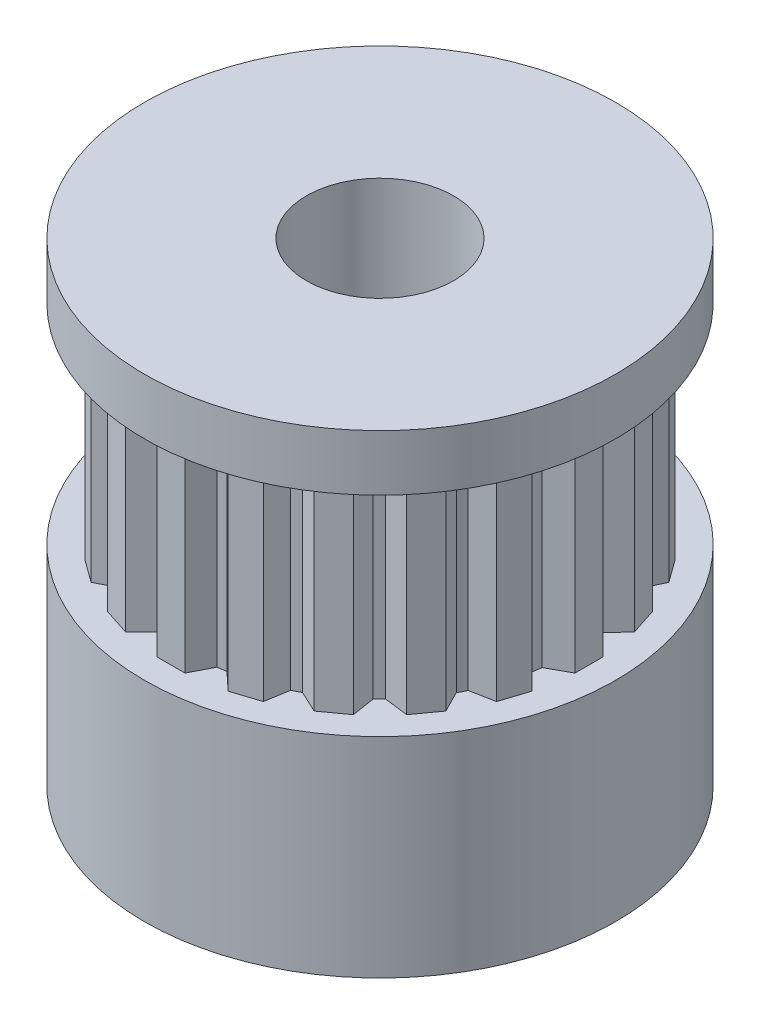
from build123d import *

# Parameters (mm, degrees)
SKETCH1_R               = 8
BOSS_EXTRUDE1_DEPTH     = 7.1
BOSS_EXTRUDE2_DEPTH     = 7.1
SKETCH3_R               = 8
BOSS_EXTRUDE3_DEPTH     = 1.9
CUT_EXTRUDE1_DEPTH      = 20.677652299
CUT_EXTRUDE1_DEPTH_BACK = 20.677652299
SKETCH4_R               = 2.5


with BuildPart() as part:
    # Sketch1 → Boss-Extrude1 (new body)
    with BuildSketch(Plane(origin=(0, 0, 0), x_dir=(1, 0, 0), z_dir=(0, 1, 0))):
        with Locations(Location((0, 0, 0), (0, 0, 270))):
            Circle(SKETCH1_R)
    extrude(amount=BOSS_EXTRUDE1_DEPTH)

    # Sketch2 → Boss-Extrude2 (add)
    with BuildSketch(Plane(origin=(0, 7.1, 0), x_dir=(1, 0, 0), z_dir=(0, 1, 0))):
        with BuildLine():
            Line((-0.475669396, 7.098967945), (-0.844267822, 6.384436135))
            ThreePointArc((-0.844267822, 6.384436135), (-0.992920102, 6.363012069), (-1.14103236, 6.338127332))
            Line((-1.14103236, 6.338127332), (-1.741313259, 6.89850965))
            Line((-1.741313259, 6.89850965), (-2.646090217, 6.604529796))
            Line((-2.646090217, 6.604529796), (-2.775845679, 5.811066484))
            ThreePointArc((-2.775845679, 5.811066484), (-2.90801175, 5.739642443), (-3.043775319, 5.675318909))
            Line((-3.043775319, 5.675318909), (-3.78784404, 6.022777166))
            Line((-3.78784404, 6.022777166), (-4.55749329, 5.463594254))
            Line((-4.55749329, 5.463594254), (-4.43570442, 4.668869158))
            ThreePointArc((-4.43570442, 4.668869158), (-4.545755036, 4.566553145), (-4.648572343, 4.45697073))
            Line((-4.648572343, 4.45697073), (-5.463594254, 4.557493289))
            Line((-5.463594254, 4.557493289), (-6.022777166, 3.787844039))
            Line((-6.022777166, 3.787844039), (-5.661365507, 3.069650389))
            ThreePointArc((-5.661365507, 3.069650389), (-5.74260171, 2.942530762), (-5.798334717, 2.802343202))
            Line((-5.798334717, 2.802343202), (-6.604529796, 2.646090216))
            Line((-6.604529796, 2.646090216), (-6.89850965, 1.741313258))
            Line((-6.89850965, 1.741313258), (-6.332852694, 1.169952852))
            ThreePointArc((-6.332852694, 1.169952852), (-6.358413277, 1.021955731), (-6.38051569, 0.873402797))
            Line((-6.38051569, 0.873402797), (-7.098967945, 0.475669396))
            Line((-7.098967945, 0.475669396), (-7.098967945, -0.475669396))
            Line((-7.098967945, -0.475669396), (-6.384436135, -0.844267822))
            ThreePointArc((-6.384436135, -0.844267822), (-6.363012069, -0.992920102), (-6.338127332, -1.14103236))
            Line((-6.338127332, -1.14103236), (-6.89850965, -1.741313259))
            Line((-6.89850965, -1.741313259), (-6.604529796, -2.646090217))
            Line((-6.604529796, -2.646090217), (-5.811066484, -2.775845679))
            ThreePointArc((-5.811066484, -2.775845679), (-5.744754906, -2.910601998), (-5.675318909, -3.043775319))
            Line((-5.675318909, -3.043775319), (-6.022777166, -3.78784404))
            Line((-6.022777166, -3.78784404), (-5.463594254, -4.55749329))
            Line((-5.463594254, -4.55749329), (-4.668869158, -4.43570442))
            ThreePointArc((-4.668869158, -4.43570442), (-4.564161106, -4.543373891), (-4.45697073, -4.648572343))
            Line((-4.45697073, -4.648572343), (-4.557493289, -5.463594254))
            Line((-4.557493289, -5.463594254), (-3.787844039, -6.022777166))
            Line((-3.787844039, -6.022777166), (-3.069650389, -5.661365507))
            ThreePointArc((-3.069650389, -5.661365507), (-2.936795417, -5.731408691), (-2.802343202, -5.798334717))
            Line((-2.802343202, -5.798334717), (-2.646090216, -6.604529796))
            Line((-2.646090216, -6.604529796), (-1.741313258, -6.89850965))
            Line((-1.741313258, -6.89850965), (-1.169952852, -6.332852694))
            ThreePointArc((-1.169952852, -6.332852694), (-1.021955731, -6.358413277), (-0.873402797, -6.38051569))
            Line((-0.873402797, -6.38051569), (-0.475669396, -7.098967945))
            Line((-0.475669396, -7.098967945), (0.475669396, -7.098967945))
            Line((0.475669396, -7.098967945), (0.844267822, -6.384436135))
            ThreePointArc((0.844267822, -6.384436135), (0.992920102, -6.363012069), (1.14103236, -6.338127332))
            Line((1.14103236, -6.338127332), (1.741313259, -6.89850965))
            Line((1.741313259, -6.89850965), (2.646090217, -6.604529796))
            Line((2.646090217, -6.604529796), (2.775845679, -5.811066484))
            ThreePointArc((2.775845679, -5.811066484), (2.910601998, -5.744754906), (3.043775319, -5.675318909))
            Line((3.043775319, -5.675318909), (3.78784404, -6.022777166))
            Line((3.78784404, -6.022777166), (4.55749329, -5.463594254))
            Line((4.55749329, -5.463594254), (4.43570442, -4.668869158))
            ThreePointArc((4.43570442, -4.668869158), (4.543373891, -4.564161106), (4.648572343, -4.45697073))
            Line((4.648572343, -4.45697073), (5.463594254, -4.557493289))
            Line((5.463594254, -4.557493289), (6.022777166, -3.787844039))
            Line((6.022777166, -3.787844039), (5.661365507, -3.069650389))
            ThreePointArc((5.661365507, -3.069650389), (5.73140869, -2.936795416), (5.798334717, -2.802343202))
            Line((5.798334717, -2.802343202), (6.604529796, -2.646090216))
            Line((6.604529796, -2.646090216), (6.89850965, -1.741313258))
            Line((6.89850965, -1.741313258), (6.332852694, -1.169952852))
            ThreePointArc((6.332852694, -1.169952852), (6.358413277, -1.021955731), (6.38051569, -0.873402797))
            Line((6.38051569, -0.873402797), (7.098967945, -0.475669396))
            Line((7.098967945, -0.475669396), (7.098967945, 0.475669396))
            Line((7.098967945, 0.475669396), (6.384436135, 0.844267822))
            ThreePointArc((6.384436135, 0.844267822), (6.363012069, 0.992920102), (6.338127332, 1.14103236))
            Line((6.338127332, 1.14103236), (6.89850965, 1.741313259))
            Line((6.89850965, 1.741313259), (6.604529796, 2.646090217))
            Line((6.604529796, 2.646090217), (5.819778459, 2.774421005))
            ThreePointArc((5.819778459, 2.774421005), (5.755101615, 2.913148935), (5.675318909, 3.043775319))
            Line((5.675318909, 3.043775319), (6.022777166, 3.78784404))
            Line((6.022777166, 3.78784404), (5.463594254, 4.55749329))
            Line((5.463594254, 4.55749329), (4.668869158, 4.43570442))
            ThreePointArc((4.668869158, 4.43570442), (4.564161105, 4.54337389), (4.45697073, 4.648572343))
            Line((4.45697073, 4.648572343), (4.557493289, 5.463594254))
            Line((4.557493289, 5.463594254), (3.787844039, 6.022777166))
            Line((3.787844039, 6.022777166), (3.069650389, 5.661365507))
            ThreePointArc((3.069650389, 5.661365507), (2.936795417, 5.731408691), (2.802343202, 5.798334717))
            Line((2.802343202, 5.798334717), (2.646090216, 6.604529796))
            Line((2.646090216, 6.604529796), (1.741313258, 6.89850965))
            Line((1.741313258, 6.89850965), (1.169952852, 6.332852694))
            Line((1.169952852, 6.332852694), (0.873402797, 6.38051569))
            Line((0.873402797, 6.38051569), (0.475669396, 7.098967945))
            Line((0.475669396, 7.098967945), (-0.475669396, 7.098967945))
        make_face()
    extrude(amount=BOSS_EXTRUDE2_DEPTH)

    # Sketch3 → Boss-Extrude3 (add)
    with BuildSketch(Plane(origin=(0, 14.2, 0), x_dir=(1, 0, 0), z_dir=(0, 1, 0))):
        with Locations(Location((0, 0, 0), (0, 0, 270))):
            Circle(SKETCH3_R)
    extrude(amount=BOSS_EXTRUDE3_DEPTH)

    # Sketch4 → Cut-Extrude1 (cut, two sides: drawn at the far end of the back side and taken through both)
    with BuildSketch(Plane(origin=(0, 16.1, 0), x_dir=(1, 0, 0), z_dir=(0, 1, 0)).offset(-CUT_EXTRUDE1_DEPTH_BACK)):
        with Locations(Location((0, 0, 0), (0, 0, 270))):
            Circle(SKETCH4_R)
    extrude(amount=CUT_EXTRUDE1_DEPTH + CUT_EXTRUDE1_DEPTH_BACK, mode=Mode.SUBTRACT)


solid = part.part
